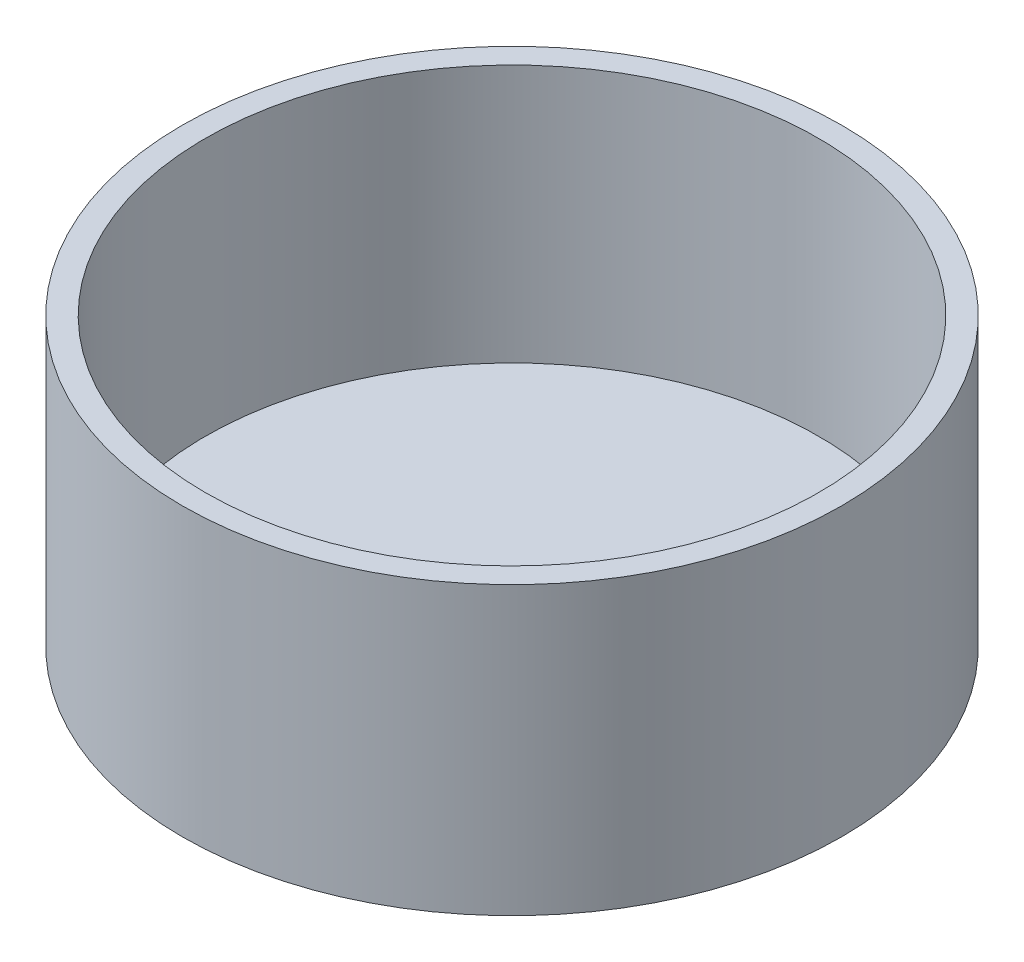
from build123d import *

# Parameters (mm, degrees)
SKETCH_1_R      = 21.4
EXTRUDE_1_DEPTH = 2
SKETCH_2_R      = 23
SKETCH_2_R_2    = 21.4
EXTRUDE_2_DEPTH = 20


with BuildPart() as part:
    # 草图1 → 凸台-拉伸1 (new body)
    with BuildSketch(Plane(origin=(0, 0, 0), x_dir=(1, 0, 0), z_dir=(0, 1, 0))):
        with Locations(Location((0, 0, 0), (0, 0, 270))):
            Circle(SKETCH_1_R)
    extrude(amount=EXTRUDE_1_DEPTH)

    # 草图2 → 凸台-拉伸2 (add)
    with BuildSketch(Plane(origin=(0, 0, 0), x_dir=(1, 0, 0), z_dir=(0, 1, 0))):
        with Locations(Location((0, 0, 0), (0, 0, 270))):
            Circle(SKETCH_2_R)
        with Locations(Location((0, 0, 0), (0, 0, 270))):
            Circle(SKETCH_2_R_2, mode=Mode.SUBTRACT)
    extrude(amount=EXTRUDE_2_DEPTH)


solid = part.part
